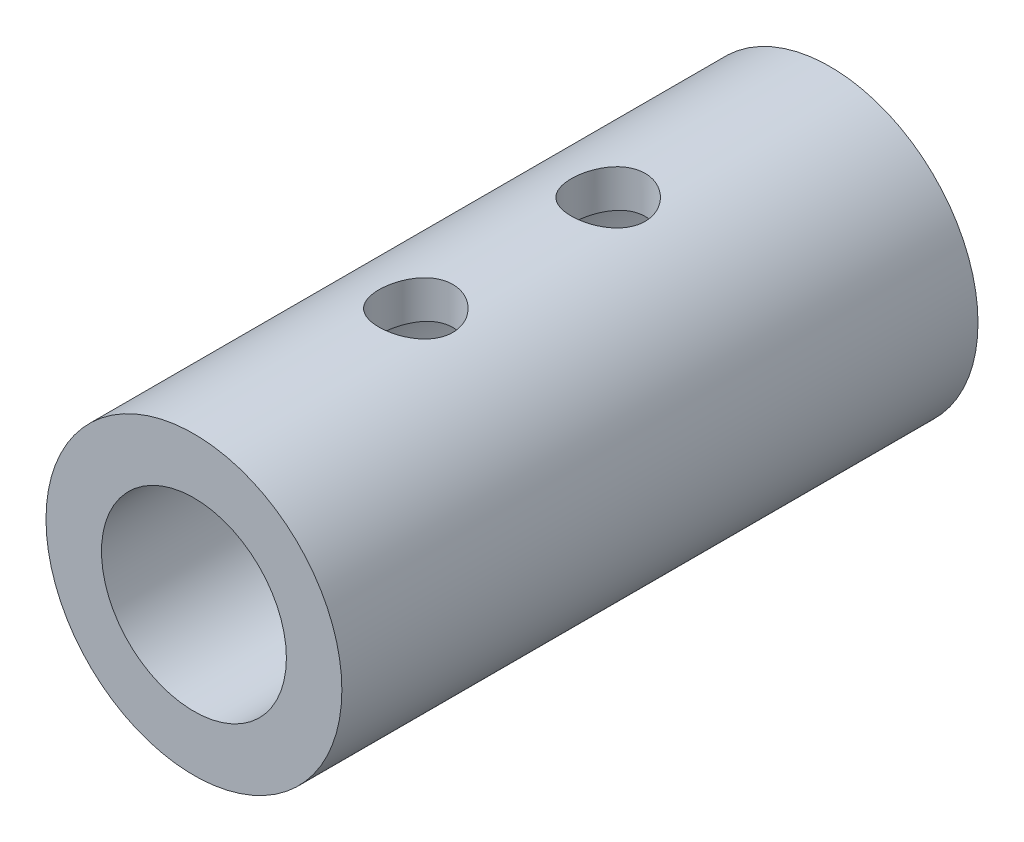
from build123d import *

# Parameters (mm, degrees)
CROQUIS1_R                 = 10
CROQUIS1_R_2               = 6.25
SALIENTE_EXTRUIR1_DEPTH    = 13
SALIENTE_EXTRUIR2_START    = -30
CROQUIS2_R                 = 10
CROQUIS2_R_2               = 7.48
SALIENTE_EXTRUIR2_DEPTH    = 30
CORTAR_EXTRUIR1_DEPTH      = 39.57274278
CORTAR_EXTRUIR1_DEPTH_BACK = 39.57274278
CROQUIS3_R                 = 2.5


with BuildPart() as part:
    # Croquis1 → Saliente-Extruir1 (new body)
    with BuildSketch(Plane.XY):
        with Locations((-9.736276302, -4.083177315)):
            Circle(CROQUIS1_R)
        with Locations((-9.736276302, -4.083177315)):
            Circle(CROQUIS1_R_2, mode=Mode.SUBTRACT)
    extrude(amount=SALIENTE_EXTRUIR1_DEPTH)

    # Croquis2 → Saliente-Extruir2 (add)
    with BuildSketch(Plane.XY.offset(SALIENTE_EXTRUIR2_START)):
        with Locations((-9.736276302, -4.083177315)):
            Circle(CROQUIS2_R)
        with Locations((-9.736276302, -4.083177315)):
            Circle(CROQUIS2_R_2, mode=Mode.SUBTRACT)
    extrude(amount=SALIENTE_EXTRUIR2_DEPTH)

    # Croquis3 → Cortar-Extruir1 (cut, two sides: drawn at the far end of the back side and taken through both)
    with BuildSketch(Plane(origin=(0, 0, 0), x_dir=(1, 0, 0), z_dir=(0, 1, 0)).offset(-CORTAR_EXTRUIR1_DEPTH_BACK)):
        with Locations((-9.736276302, 15)):
            Circle(CROQUIS3_R)
        with Locations((-9.736276302, 2)):
            Circle(CROQUIS3_R)
    extrude(amount=CORTAR_EXTRUIR1_DEPTH + CORTAR_EXTRUIR1_DEPTH_BACK, mode=Mode.SUBTRACT)


solid = part.part
